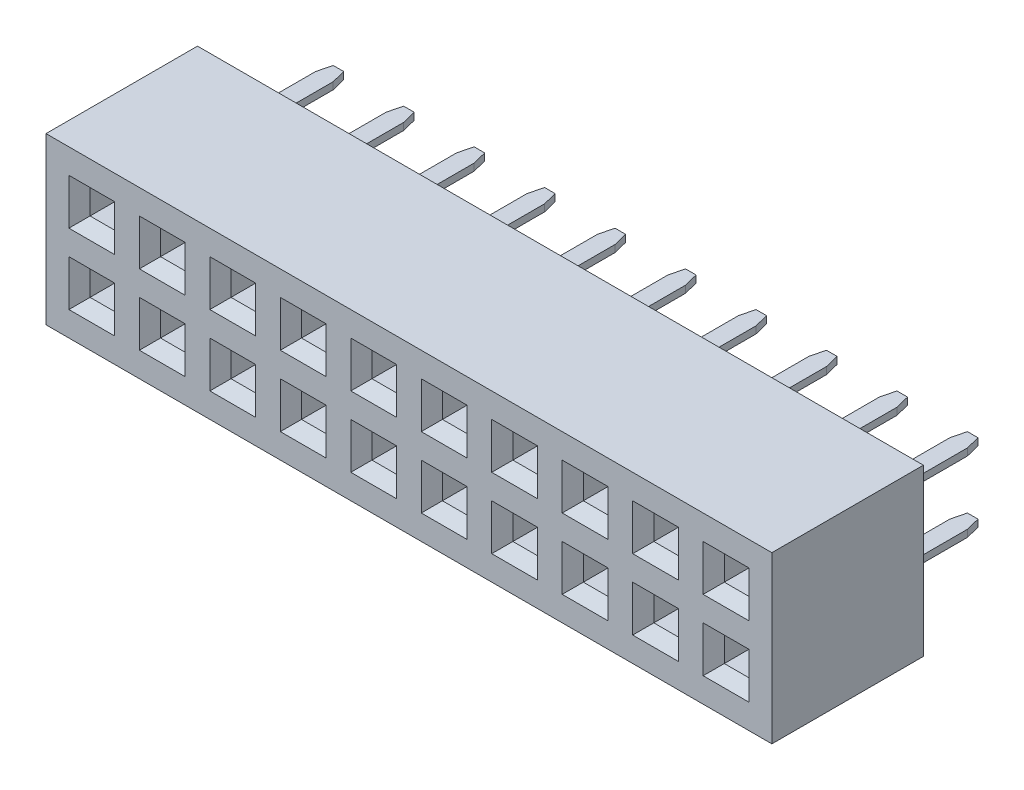
from build123d import *
from OCP.BRepFilletAPI import BRepFilletAPI_MakeChamfer

# Parameters (mm, degrees)
SKETCH_1_W                         = 20.6
SKETCH_1_H                         = 4.7
EXTRUDE_1_DEPTH                    = 4.3
SKETCH_2_W                         = 0.7
SKETCH_2_H                         = 0.7
CUT_EXTRUDE_1_DEPTH                = 3
CHAMFER_1_SIZE                     = 0.3
SKETCH_3_W                         = 0.5
SKETCH_3_H                         = 0.2
EXTRUDE_2_DEPTH                    = 2.7
CHAMFER_2_SIZE                     = 0.4
CHAMFER_2_SIZE2                    = 0.1
PATTERN_LINEAR_1_COUNT             = 10
PATTERN_LINEAR_1_PITCH             = 2
PATTERN_LINEAR_1_COUNT_DIR2        = 2
PATTERN_LINEAR_1_PITCH_DIR2        = 2
CHAMFER_1_OF_PATTERN_LINEAR_1_SIZE = 0.3
PATTERN_LINEAR_2_COUNT             = 10
PATTERN_LINEAR_2_PITCH             = 2
PATTERN_LINEAR_2_2_COUNT           = 2
PATTERN_LINEAR_2_2_PITCH           = 2


with BuildPart() as part:
    # Эскиз1 → Бобышка-Вытянуть1 (new body)
    with BuildSketch(Plane.XY):
        Rectangle(SKETCH_1_W, SKETCH_1_H)
    extrude(amount=EXTRUDE_1_DEPTH)

    # Эскиз2 → Вырез-Вытянуть1 (cut)
    with BuildSketch(Plane.XY.offset(4.3)):
        with Locations((-9, -1)):
            Rectangle(SKETCH_2_W, SKETCH_2_H)
    cut_extrude_1 = extrude(amount=-CUT_EXTRUDE_1_DEPTH, mode=Mode.SUBTRACT)

    # Фаска1
    chamfer_1_edges = [part.edges().sort_by_distance(p)[0] for p in [
        (-8.65, -1, 4.3),
        (-9, -0.65, 4.3),
        (-9.35, -1, 4.3),
        (-9, -1.35, 4.3),
    ]]
    chamfer(chamfer_1_edges, length=CHAMFER_1_SIZE)

    # Линейный массив1: Cut-Extrude 1 10 × 2
    with Locations(*[(i * PATTERN_LINEAR_1_PITCH, j * PATTERN_LINEAR_1_PITCH_DIR2, 0) for i in range(PATTERN_LINEAR_1_COUNT) for j in range(PATTERN_LINEAR_1_COUNT_DIR2) if (i, j) != (0, 0)]):
        add(cut_extrude_1, mode=Mode.SUBTRACT)

    # Фаска1 of Линейный массив1
    chamfer_1_of_pattern_linear_1_edges = [part.edges().sort_by_distance(p)[0] for p in [
        (-8.65, 1, 4.3),
        (-9, 1.35, 4.3),
        (-9.35, 1, 4.3),
        (-9, 0.65, 4.3),
        (-6.65, -1, 4.3),
        (-7, -0.65, 4.3),
        (-7.35, -1, 4.3),
        (-7, -1.35, 4.3),
        (-6.65, 1, 4.3),
        (-7, 1.35, 4.3),
        (-7.35, 1, 4.3),
        (-7, 0.65, 4.3),
        (-4.65, -1, 4.3),
        (-5, -0.65, 4.3),
        (-5.35, -1, 4.3),
        (-5, -1.35, 4.3),
        (-4.65, 1, 4.3),
        (-5, 1.35, 4.3),
        (-5.35, 1, 4.3),
        (-5, 0.65, 4.3),
        (-2.65, -1, 4.3),
        (-3, -0.65, 4.3),
        (-3.35, -1, 4.3),
        (-3, -1.35, 4.3),
        (-2.65, 1, 4.3),
        (-3, 1.35, 4.3),
        (-3.35, 1, 4.3),
        (-3, 0.65, 4.3),
        (-0.65, -1, 4.3),
        (-1, -0.65, 4.3),
        (-1.35, -1, 4.3),
        (-1, -1.35, 4.3),
        (-0.65, 1, 4.3),
        (-1, 1.35, 4.3),
        (-1.35, 1, 4.3),
        (-1, 0.65, 4.3),
        (1.35, -1, 4.3),
        (1, -0.65, 4.3),
        (0.65, -1, 4.3),
        (1, -1.35, 4.3),
        (1.35, 1, 4.3),
        (1, 1.35, 4.3),
        (0.65, 1, 4.3),
        (1, 0.65, 4.3),
        (3.35, -1, 4.3),
        (3, -0.65, 4.3),
        (2.65, -1, 4.3),
        (3, -1.35, 4.3),
        (3.35, 1, 4.3),
        (3, 1.35, 4.3),
        (2.65, 1, 4.3),
        (3, 0.65, 4.3),
        (5.35, -1, 4.3),
        (5, -0.65, 4.3),
        (4.65, -1, 4.3),
        (5, -1.35, 4.3),
        (5.35, 1, 4.3),
        (5, 1.35, 4.3),
        (4.65, 1, 4.3),
        (5, 0.65, 4.3),
        (7.35, -1, 4.3),
        (7, -0.65, 4.3),
        (6.65, -1, 4.3),
        (7, -1.35, 4.3),
        (7.35, 1, 4.3),
        (7, 1.35, 4.3),
        (6.65, 1, 4.3),
        (7, 0.65, 4.3),
        (9.35, -1, 4.3),
        (9, -0.65, 4.3),
        (8.65, -1, 4.3),
        (9, -1.35, 4.3),
        (9.35, 1, 4.3),
        (9, 1.35, 4.3),
        (8.65, 1, 4.3),
        (9, 0.65, 4.3),
    ]]
    chamfer(chamfer_1_of_pattern_linear_1_edges, length=CHAMFER_1_OF_PATTERN_LINEAR_1_SIZE)


with BuildPart() as body_2:
    # Эскиз3 → Бобышка-Вытянуть2 (new body)
    with BuildSketch(Plane(origin=(0, 0, 0), x_dir=(-1, 0, 0), z_dir=(0, 0, -1))):
        with Locations((9, -1)):
            Rectangle(SKETCH_3_W, SKETCH_3_H)
    extrude(amount=EXTRUDE_2_DEPTH)

    # Фаска2: one chamfer whose edges measure the first distance from different faces: ONE call of the kernel's chamfer builder (chamfer() names one face for all edges)
    chamfer_2_edges_1 = [body_2.edges().sort_by_distance(p)[0] for p in [
        (-8.75, -1, -2.7),
    ]]
    chamfer_2_side_1 = [body_2.faces().sort_by_distance(p)[0] for p in [
        (-8.75, -1, -1.35),
    ]]
    chamfer_2_edges_2 = [body_2.edges().sort_by_distance(p)[0] for p in [
        (-9.25, -1, -2.7),
    ]]
    chamfer_2_side_2 = [body_2.faces().sort_by_distance(p)[0] for p in [
        (-9.25, -1, -1.35),
    ]]
    chamfer_2 = BRepFilletAPI_MakeChamfer(body_2.part.solid().wrapped)
    for e in chamfer_2_edges_1:
        chamfer_2.Add(CHAMFER_2_SIZE, CHAMFER_2_SIZE2, e.wrapped, chamfer_2_side_1[0].wrapped)  # the first distance lies on this face
    for e in chamfer_2_edges_2:
        chamfer_2.Add(CHAMFER_2_SIZE, CHAMFER_2_SIZE2, e.wrapped, chamfer_2_side_2[0].wrapped)  # the first distance lies on this face
    add(Compound.cast(chamfer_2.Shape()), mode=Mode.REPLACE)


with BuildPart() as pattern_linear_2_1:
    # Линейный массив2: pattern copy
    add(body_2.part.moved(Location(Vector(1, 0, 0) * (1 * PATTERN_LINEAR_2_PITCH))))


with BuildPart() as pattern_linear_2_2:
    # Линейный массив2: pattern copy
    add(body_2.part.moved(Location(Vector(1, 0, 0) * (2 * PATTERN_LINEAR_2_PITCH))))


with BuildPart() as pattern_linear_2_3:
    # Линейный массив2: pattern copy
    add(body_2.part.moved(Location(Vector(1, 0, 0) * (3 * PATTERN_LINEAR_2_PITCH))))


with BuildPart() as pattern_linear_2_4:
    # Линейный массив2: pattern copy
    add(body_2.part.moved(Location(Vector(1, 0, 0) * (4 * PATTERN_LINEAR_2_PITCH))))


with BuildPart() as pattern_linear_2_5:
    # Линейный массив2: pattern copy
    add(body_2.part.moved(Location(Vector(1, 0, 0) * (5 * PATTERN_LINEAR_2_PITCH))))


with BuildPart() as pattern_linear_2_6:
    # Линейный массив2: pattern copy
    add(body_2.part.moved(Location(Vector(1, 0, 0) * (6 * PATTERN_LINEAR_2_PITCH))))


with BuildPart() as pattern_linear_2_7:
    # Линейный массив2: pattern copy
    add(body_2.part.moved(Location(Vector(1, 0, 0) * (7 * PATTERN_LINEAR_2_PITCH))))


with BuildPart() as pattern_linear_2_8:
    # Линейный массив2: pattern copy
    add(body_2.part.moved(Location(Vector(1, 0, 0) * (8 * PATTERN_LINEAR_2_PITCH))))


with BuildPart() as pattern_linear_2_9:
    # Линейный массив2: pattern copy
    add(body_2.part.moved(Location(Vector(1, 0, 0) * (9 * PATTERN_LINEAR_2_PITCH))))


with BuildPart() as pattern_linear_2_2_1:
    # Pattern Linear 2 2: pattern copy
    add(body_2.part.moved(Location(Vector(0, 1, 0) * (1 * PATTERN_LINEAR_2_2_PITCH))))


with BuildPart() as pattern_linear_2_2_2:
    # Pattern Linear 2 2: pattern copy
    add(pattern_linear_2_1.part.moved(Location(Vector(0, 1, 0) * (1 * PATTERN_LINEAR_2_2_PITCH))))


with BuildPart() as pattern_linear_2_2_3:
    # Pattern Linear 2 2: pattern copy
    add(pattern_linear_2_2.part.moved(Location(Vector(0, 1, 0) * (1 * PATTERN_LINEAR_2_2_PITCH))))


with BuildPart() as pattern_linear_2_2_4:
    # Pattern Linear 2 2: pattern copy
    add(pattern_linear_2_3.part.moved(Location(Vector(0, 1, 0) * (1 * PATTERN_LINEAR_2_2_PITCH))))


with BuildPart() as pattern_linear_2_2_5:
    # Pattern Linear 2 2: pattern copy
    add(pattern_linear_2_4.part.moved(Location(Vector(0, 1, 0) * (1 * PATTERN_LINEAR_2_2_PITCH))))


with BuildPart() as pattern_linear_2_2_6:
    # Pattern Linear 2 2: pattern copy
    add(pattern_linear_2_5.part.moved(Location(Vector(0, 1, 0) * (1 * PATTERN_LINEAR_2_2_PITCH))))


with BuildPart() as pattern_linear_2_2_7:
    # Pattern Linear 2 2: pattern copy
    add(pattern_linear_2_6.part.moved(Location(Vector(0, 1, 0) * (1 * PATTERN_LINEAR_2_2_PITCH))))


with BuildPart() as pattern_linear_2_2_8:
    # Pattern Linear 2 2: pattern copy
    add(pattern_linear_2_7.part.moved(Location(Vector(0, 1, 0) * (1 * PATTERN_LINEAR_2_2_PITCH))))


with BuildPart() as pattern_linear_2_2_9:
    # Pattern Linear 2 2: pattern copy
    add(pattern_linear_2_8.part.moved(Location(Vector(0, 1, 0) * (1 * PATTERN_LINEAR_2_2_PITCH))))


with BuildPart() as pattern_linear_2_2_10:
    # Pattern Linear 2 2: pattern copy
    add(pattern_linear_2_9.part.moved(Location(Vector(0, 1, 0) * (1 * PATTERN_LINEAR_2_2_PITCH))))


solid = Compound([part.part, body_2.part, pattern_linear_2_1.part, pattern_linear_2_2.part, pattern_linear_2_3.part, pattern_linear_2_4.part, pattern_linear_2_5.part, pattern_linear_2_6.part, pattern_linear_2_7.part, pattern_linear_2_8.part, pattern_linear_2_9.part, pattern_linear_2_2_1.part, pattern_linear_2_2_2.part, pattern_linear_2_2_3.part, pattern_linear_2_2_4.part, pattern_linear_2_2_5.part, pattern_linear_2_2_6.part, pattern_linear_2_2_7.part, pattern_linear_2_2_8.part, pattern_linear_2_2_9.part, pattern_linear_2_2_10.part])
